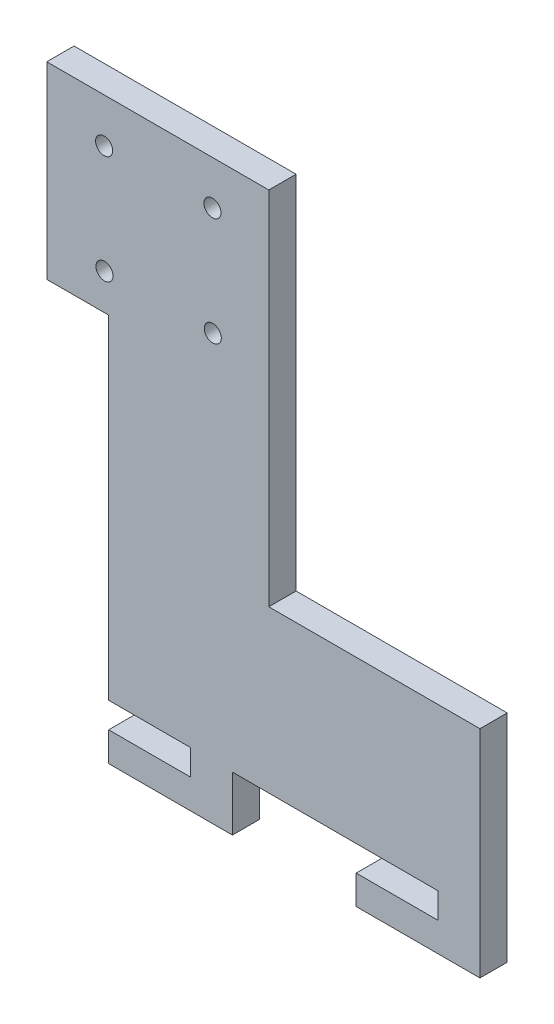
from build123d import *

# Parameters (mm, degrees)
SKETCH1_W           = 76.2
SKETCH1_H           = 96.655493252
BOSS_EXTRUDE1_DEPTH = 4.800000052
SKETCH4_W           = 37.141404
SKETCH4_H           = 63.5
CUT_EXTRUDE3_DEPTH  = 124.173716256
SKETCH5_W           = 10.885714286
SKETCH5_H           = 63.5
CUT_EXTRUDE4_DEPTH  = 124.173716256
SKETCH6_W           = 65.314285714
SKETCH6_H           = 4.800000052
BOSS_EXTRUDE2_DEPTH = 4.826
SKETCH7_W           = 14.405428571
SKETCH7_H           = 4.500000144
CUT_EXTRUDE5_DEPTH  = 124.173716256
SKETCH8_R           = 1.5
CUT_EXTRUDE6_DEPTH  = 169.085270166


with BuildPart() as part:
    # Sketch1 → Boss-Extrude1 (new body)
    with BuildSketch(Plane.XY):
        with Locations((38.1, 48.327746626)):
            Rectangle(SKETCH1_W, SKETCH1_H)
    extrude(amount=BOSS_EXTRUDE1_DEPTH)

    # Sketch4 → Cut-Extrude3 (cut, through all)
    with BuildSketch(Plane.XY.offset(4.800000052)):
        with Locations((57.629298, 64.905493252)):
            Rectangle(SKETCH4_W, SKETCH4_H)
    extrude(amount=-CUT_EXTRUDE3_DEPTH, mode=Mode.SUBTRACT)

    # Sketch5 → Cut-Extrude4 (cut, through all)
    with BuildSketch(Plane.XY.offset(4.800000052)):
        with Locations((5.442857143, 31.75)):
            Rectangle(SKETCH5_W, SKETCH5_H)
    extrude(amount=-CUT_EXTRUDE4_DEPTH, mode=Mode.SUBTRACT)

    # Sketch6 → Boss-Extrude2 (add)
    with BuildSketch(Plane.XZ):
        with Locations((43.542857143, 2.400000026)):
            Rectangle(SKETCH6_W, SKETCH6_H)
    extrude(amount=BOSS_EXTRUDE2_DEPTH)

    # Sketch7 → Cut-Extrude5 (cut, through all)
    with BuildSketch(Plane.XY.offset(4.800000052)):
        with Locations((18.088428571, 2.575999928)):
            Rectangle(SKETCH7_W, SKETCH7_H)
        Polygon((32.657142857, 4.774000104), (32.657142857, -4.826), (54.428571429, -4.826), (54.428571429, 0.27399996), (54.428571429, 4.774000104), align=None)
        with Locations((61.631285715, 2.524000032)):
            Rectangle(SKETCH7_W, SKETCH7_H)
    extrude(amount=-CUT_EXTRUDE5_DEPTH, mode=Mode.SUBTRACT)

    # Sketch8 → Cut-Extrude6 (cut, through all)
    with BuildSketch(Plane(origin=(29.45757895, -64.728409664, 4.800000052), x_dir=(1, 0, 0), z_dir=(0, 0, 1))):
        with Locations((-0.254377116, 134.631060555)):
            Circle(SKETCH8_R)
        with Locations((-0.316557328, 153.680959075)):
            Circle(SKETCH8_R)
        with Locations((-19.304275636, 134.568880343)):
            Circle(SKETCH8_R)
        with Locations((-19.366455848, 153.618778863)):
            Circle(SKETCH8_R)
    extrude(amount=-CUT_EXTRUDE6_DEPTH, mode=Mode.SUBTRACT)


solid = part.part
